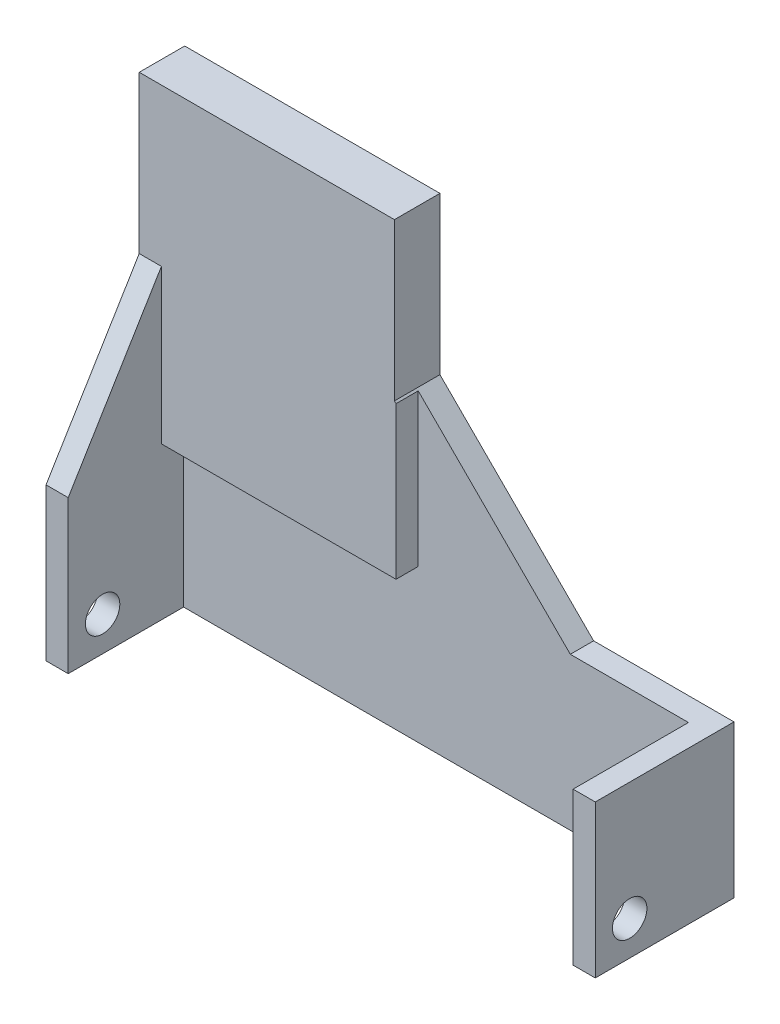
from build123d import *

# Parameters (mm, degrees)
PROFILEBOSS_EXTRUDE3_DEPTH            = 41.74
SKETCH5_R                             = 1.55
SHROUDHOLESCUT_EXTRUDE1_DEPTH         = 66.944883046
SIDECUTOUTCUT_EXTRUDE3_DEPTH          = 66.944883046
FRONTCUTOUTCUT_EXTRUDE4_DEPTH         = 65.457176482
SKETCH11_R                            = 2.25
DRAGCHAINMOUNTHOLESCUT_EXTRUDE6_DEPTH = 3.1
CUT_EXTRUDE7_DEPTH                    = 2


with BuildPart() as part:
    # Sketch4 → ProfileBoss-Extrude3 (new body)
    with BuildSketch(Plane(origin=(0, 0, 0), x_dir=(1, 0, 0), z_dir=(0, 1, 0))):
        Polygon((0, 0), (0, 8.4), (45.5, 8.4), (45.5, 0), (47.5, 0), (47.5, 12.5), (-2, 12.5), (-2, 0), align=None)
    extrude(amount=PROFILEBOSS_EXTRUDE3_DEPTH)

    # Sketch5 → ShroudHolesCut-Extrude1 (cut, through all)
    with BuildSketch(Plane(origin=(47.5, 0, 0), x_dir=(0, 0, -1), z_dir=(1, 0, 0))):
        with Locations((3.1, 3.1)):
            Circle(SKETCH5_R)
    extrude(amount=-SHROUDHOLESCUT_EXTRUDE1_DEPTH, mode=Mode.SUBTRACT)

    # SideCutoutSketch9 → SideCutoutCut-Extrude3 (cut, through all)
    with BuildSketch(Plane.ZY.offset(2)):
        Polygon((0, 41.74), (-8.4, 41.74), (-8.4, 27.59), (0, 13.74), align=None)
    extrude(amount=-SIDECUTOUTCUT_EXTRUDE3_DEPTH, mode=Mode.SUBTRACT)

    # FrontCutoutSketch7 → FrontCutoutCut-Extrude4 (cut, through all)
    with BuildSketch(Plane(origin=(0, 0, -12.5), x_dir=(-1, 0, 0), z_dir=(0, 0, -1))):
        Polygon((-21, 41.74), (-21, 27.59), (-34.85, 13.74), (-47.5, 13.74), (-47.5, 41.74), align=None)
    extrude(amount=-FRONTCUTOUTCUT_EXTRUDE4_DEPTH, mode=Mode.SUBTRACT)

    # Sketch11 → DragChainMountHolesCut-Extrude6 (cut)
    with BuildSketch(Plane(origin=(0, 0, -12.5), x_dir=(-1, 0, 0), z_dir=(0, 0, -1))):
        with Locations((-3, 21.74)):
            Circle(SKETCH11_R)
        with Locations((-10.5, 27.74)):
            Circle(SKETCH11_R)
        with Locations((-3, 33.74)):
            Circle(SKETCH11_R)
    extrude(amount=-DRAGCHAINMOUNTHOLESCUT_EXTRUDE6_DEPTH, mode=Mode.SUBTRACT)

    # Sketch13 → Cut-Extrude7 (cut)
    with BuildSketch(Plane.XY.offset(-8.4)):
        Polygon((21.142710497, 27.447289503), (34.85, 13.74), (45.5, 13.74), (45.5, 0), (0, 0), (0, 13.74), (21.142710497, 13.74), align=None)
    extrude(amount=-CUT_EXTRUDE7_DEPTH, mode=Mode.SUBTRACT)


solid = part.part
